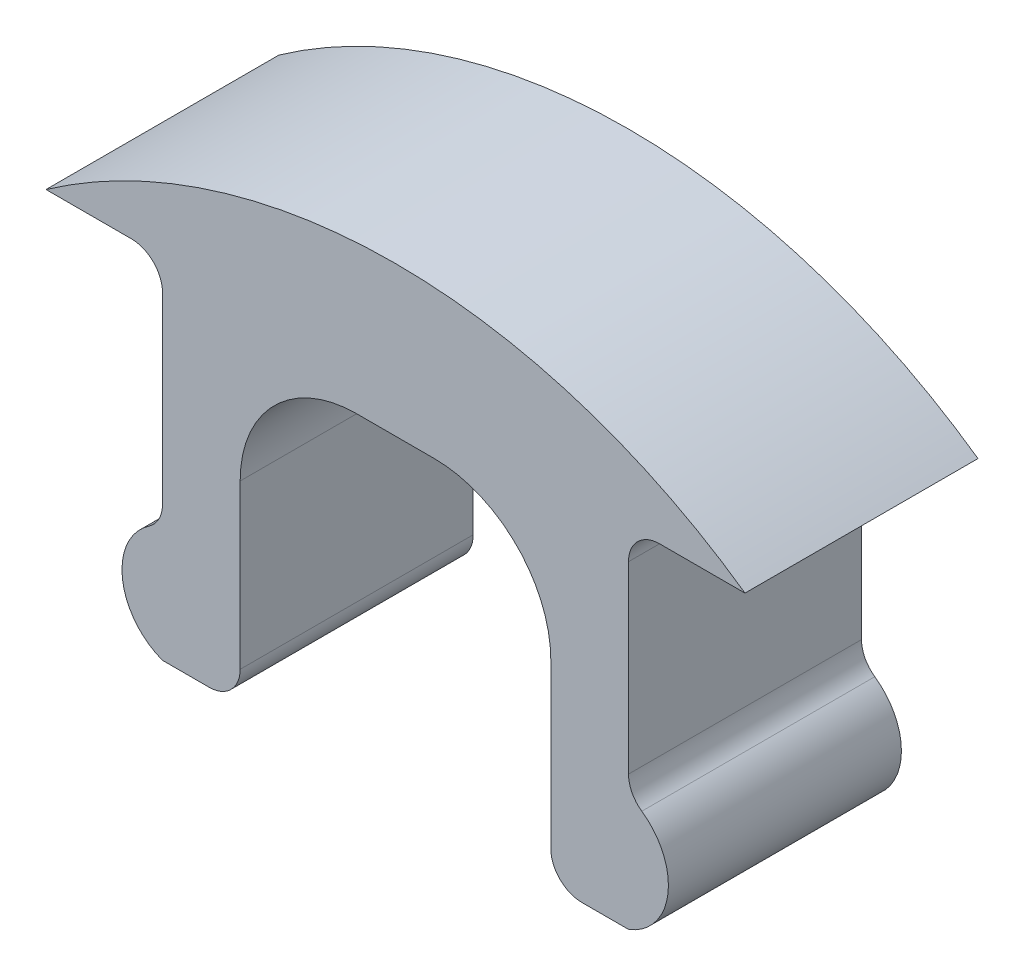
from build123d import *

# Parameters (mm, degrees)
DODANIE_WYCI_GNI_CIE1_DEPTH = 3
ZAOKR_GLENIE2_R             = 0.4
ZAOKR_GLENIE3_R             = 1.5


with BuildPart() as part:
    # Szkic1 → Dodanie-wyciągnięcie1 (new body)
    with BuildSketch(Plane.XY):
        with BuildLine():
            Line((0, 3), (-1.5, 3))
            ThreePointArc((-1.5, 3), (3, 4.425195836), (7.5, 3))
            Line((7.5, 3), (6, 3))
            Line((6, 3), (6, -0.005902175))
            ThreePointArc((6, -0.005902175), (6.513786929, -0.752951087), (6, -1.5))
            Line((6, -1.5), (5, -1.5))
            Line((5, -1.5), (5, 2.5))
            Line((5, 2.5), (1, 2.5))
            Line((1, 2.5), (1, -1.5))
            Line((1, -1.5), (0, -1.5))
            ThreePointArc((0, -1.5), (-0.521611782, -0.75), (0, 0))
            Line((0, 0), (0, 3))
        make_face()
    extrude(amount=DODANIE_WYCI_GNI_CIE1_DEPTH)

    # Zaokrąglenie2
    zaokr_glenie2_edges = [part.edges().sort_by_distance(p)[0] for p in [
        (0, 0, 1.5),
        (0, 3, 1.5),
        (6, 3, 1.5),
        (6, -0.005902175, 1.5),
        (5, -1.5, 1.5),
        (1, -1.5, 1.5),
    ]]
    fillet(zaokr_glenie2_edges, radius=ZAOKR_GLENIE2_R)

    # Zaokrąglenie3
    zaokr_glenie3_edges = [part.edges().sort_by_distance(p)[0] for p in [
        (5, 2.5, 1.5),
        (1, 2.5, 1.5),
    ]]
    fillet(zaokr_glenie3_edges, radius=ZAOKR_GLENIE3_R)


solid = part.part
